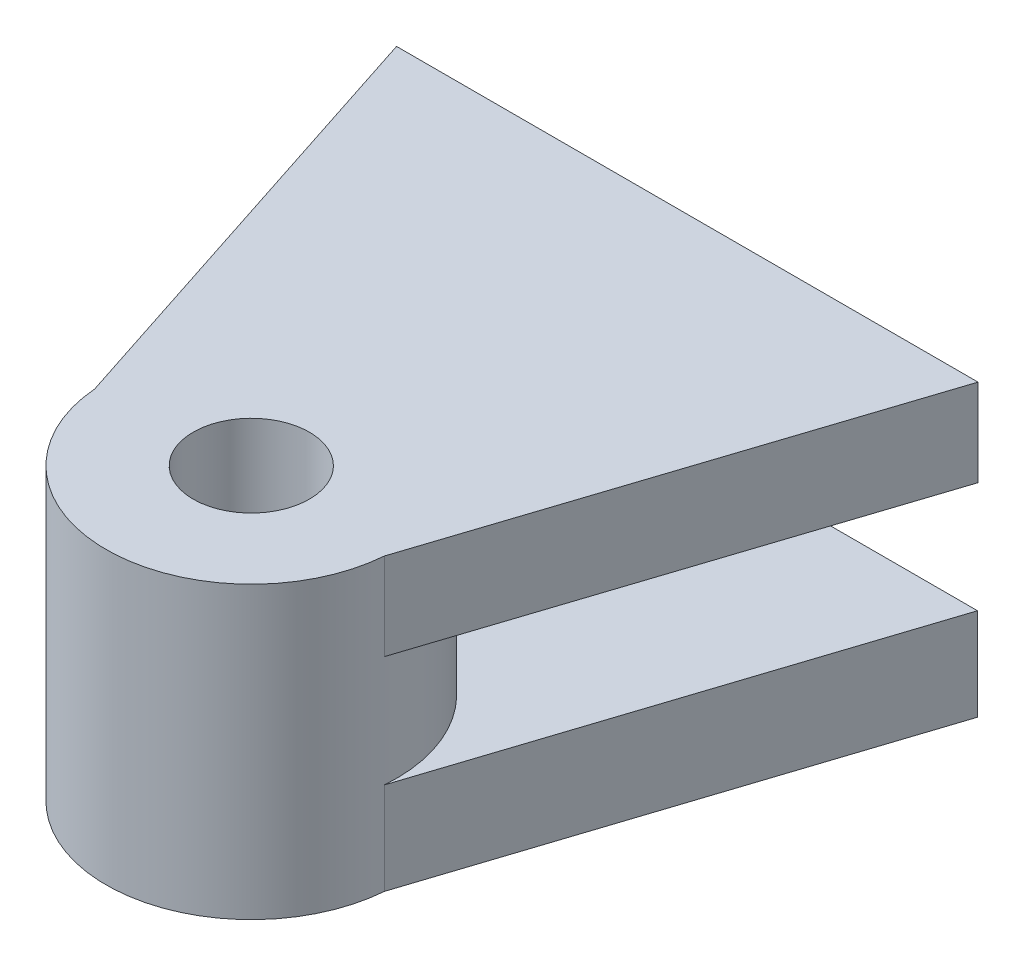
from build123d import *

# Parameters (mm, degrees)
SKETCH1_R           = 4
BOSS_EXTRUDE1_DEPTH = 6.35
SKETCH1_3_R         = 4
BOSS_EXTRUDE2_DEPTH = 20
BOSS_EXTRUDE3_START = -6
SKETCH2_R           = 4
BOSS_EXTRUDE3_DEPTH = 6


with BuildPart() as part:
    # Sketch1 → Boss-Extrude1 (new body)
    with BuildSketch(Plane(origin=(0, 0, 0), x_dir=(1, 0, 0), z_dir=(0, 1, 0))):
        with BuildLine():
            Line((0, 0), (10.032558322, -30.806291758))
            ThreePointArc((10.032558322, -30.806291758), (20, -40), (29.967441678, -30.806291758))
            Line((29.967441678, -30.806291758), (40, 0))
            Line((40, 0), (0, 0))
        make_face()
        with Locations((20, -30)):
            Circle(SKETCH1_R, mode=Mode.SUBTRACT)
    extrude(amount=BOSS_EXTRUDE1_DEPTH)

    # Sketch1<3> → Boss-Extrude2 (add)
    with BuildSketch(Plane(origin=(0, 0, 0), x_dir=(1, 0, 0), z_dir=(0, 1, 0))):
        with BuildLine():
            Line((5.258465246, 0), (0, 0))
            Line((0, 0), (10.032558322, -30.806291758))
            ThreePointArc((10.032558322, -30.806291758), (29.422749475, -33.34840146), (12.776404659, -23.084823187))
            Line((12.776404659, -23.084823187), (5.258465246, 0))
        make_face()
        with Locations((20, -30)):
            Circle(SKETCH1_3_R, mode=Mode.SUBTRACT)
    extrude(amount=BOSS_EXTRUDE2_DEPTH)

    # Sketch2 → Boss-Extrude3 (add)
    with BuildSketch(Plane(origin=(0, 20, 0), x_dir=(1, 0, 0), z_dir=(0, 1, 0)).offset(BOSS_EXTRUDE3_START)):
        with BuildLine():
            Line((40.034175669, 0), (0, 0))
            Line((0, 0), (10.032558322, -30.806291758))
            ThreePointArc((10.032558322, -30.806291758), (20, -40), (29.967441678, -30.806291758))
            Line((29.967441678, -30.806291758), (40.034175669, 0))
        make_face()
        with Locations((20, -30)):
            Circle(SKETCH2_R, mode=Mode.SUBTRACT)
    extrude(amount=BOSS_EXTRUDE3_DEPTH)


solid = part.part
